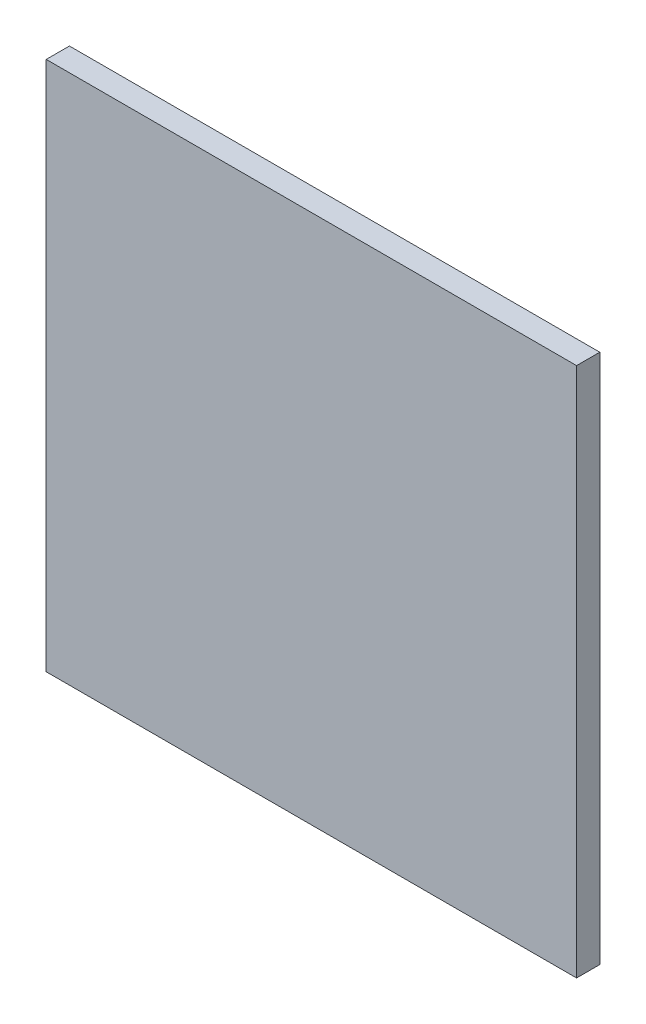
from build123d import *

# Parameters (mm, degrees)
SKICA1_W                 = 160
SKICA1_H                 = 160
P_IDAT_VYSUNUT_M1_DEPTH  = 7
ODEBRAT_VYSUNUT_M1_DEPTH = 1
SKICA1_6_R               = 76
ODEBRAT_VYSUNUT_M3_DEPTH = 3


with BuildPart() as part:
    # Skica1 → Přidat vysunutím1 (new body)
    with BuildSketch(Plane.XY):
        Rectangle(SKICA1_W, SKICA1_H)
    extrude(amount=P_IDAT_VYSUNUT_M1_DEPTH)

    # Skica1<5> → Odebrat vysunutím1 (cut)
    with BuildSketch(Plane.XY):
        Polygon((11, 27), (11, 51), (-11, 51), (-11, 27), (-27, 27), (-27, 11), (-51, 11), (-51, -11), (-27, -11), (-27, -27), (-11, -27), (-11, -51), (11, -51), (11, -27), (27, -27), (27, -11), (51, -11), (51, 11), (27, 11), (27, 27), align=None)
    extrude(amount=ODEBRAT_VYSUNUT_M1_DEPTH, mode=Mode.SUBTRACT)

    # Skica1<6> → Odebrat vysunutím3 (cut)
    with BuildSketch(Plane.XY):
        Circle(SKICA1_6_R)
        Polygon((-11, 51), (11, 51), (11, 27), (27, 27), (27, 11), (51, 11), (51, -11), (27, -11), (27, -27), (11, -27), (11, -51), (-11, -51), (-11, -27), (-27, -27), (-27, -11), (-51, -11), (-51, 11), (-27, 11), (-27, 27), (-11, 27), align=None, mode=Mode.SUBTRACT)
    extrude(amount=ODEBRAT_VYSUNUT_M3_DEPTH, mode=Mode.SUBTRACT)


solid = part.part
